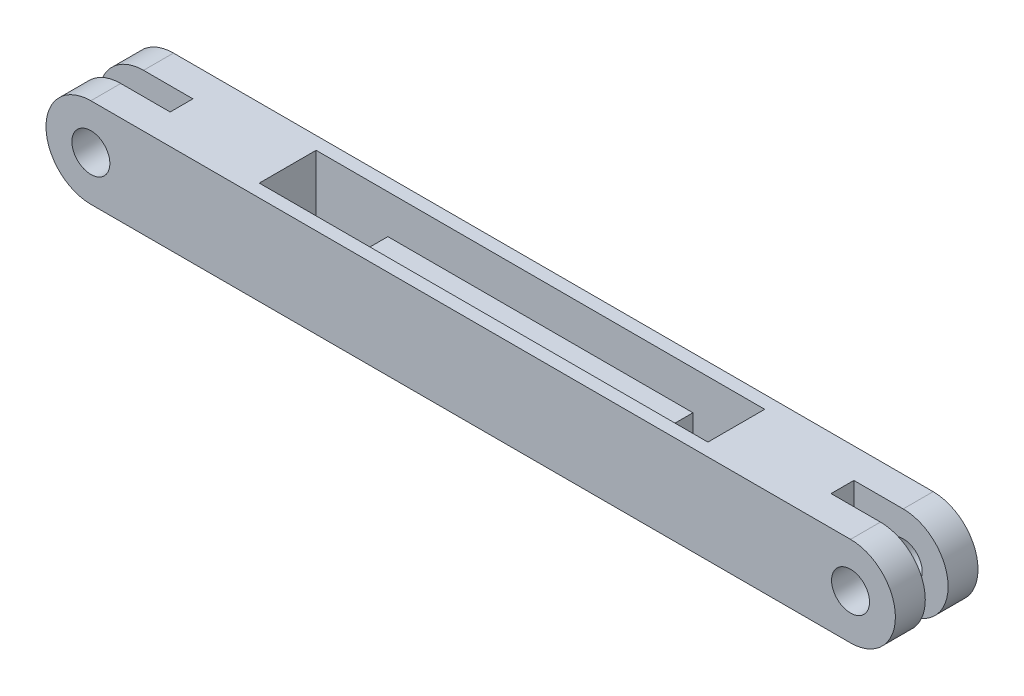
from build123d import *

# Parameters (mm, degrees)
SKETCH1_R           = 3.175
BOSS_EXTRUDE1_DEPTH = 5
SKETCH2_W           = 110.49
SKETCH2_H           = 15
BOSS_EXTRUDE2_DEPTH = 3.81
SKETCH5_R           = 3.175
BOSS_EXTRUDE3_DEPTH = 5
SKETCH6_W           = 75
SKETCH6_H           = 9.5
CUT_EXTRUDE1_DEPTH  = 6.5
SKETCH7_W           = 12
SKETCH7_H           = 9.5
CUT_EXTRUDE2_DEPTH  = 9.294


with BuildPart() as part:
    # Sketch1 → Boss-Extrude1 (new body)
    with BuildSketch(Plane.XY):
        with BuildLine():
            Line((-47.217391304, 7.923913043), (79.782608696, 7.923913043))
            ThreePointArc((79.782608696, 7.923913043), (87.282608696, 0.423913043), (79.782608696, -7.076086957))
            Line((79.782608696, -7.076086957), (-47.217391304, -7.076086957))
            ThreePointArc((-47.217391304, -7.076086957), (-54.717391304, 0.423913043), (-47.217391304, 7.923913043))
        make_face()
        with Locations((-47.217391304, 0.423913043)):
            Circle(SKETCH1_R, mode=Mode.SUBTRACT)
        with Locations((79.782608696, 0.423913043)):
            Circle(SKETCH1_R, mode=Mode.SUBTRACT)
    extrude(amount=BOSS_EXTRUDE1_DEPTH)

    # Sketch2 → Boss-Extrude2 (add)
    with BuildSketch(Plane.XY.offset(5)):
        with Locations((16.282608696, 0.423913043)):
            Rectangle(SKETCH2_W, SKETCH2_H)
    extrude(amount=BOSS_EXTRUDE2_DEPTH)

    # Sketch5 → Boss-Extrude3 (add)
    with BuildSketch(Plane.XY.offset(8.81)):
        with BuildLine():
            Line((-47.217391304, 7.923913043), (79.782608696, 7.923913043))
            ThreePointArc((79.782608696, 7.923913043), (87.282608696, 0.423913043), (79.782608696, -7.076086957))
            Line((79.782608696, -7.076086957), (-47.217391304, -7.076086957))
            ThreePointArc((-47.217391304, -7.076086957), (-54.717391304, 0.423913043), (-47.217391304, 7.923913043))
        make_face()
        with Locations((-47.217391304, 0.423913043)):
            Circle(SKETCH5_R, mode=Mode.SUBTRACT)
        with Locations((79.782608696, 0.423913043)):
            Circle(SKETCH5_R, mode=Mode.SUBTRACT)
    extrude(amount=BOSS_EXTRUDE3_DEPTH)

    # Sketch6 → Cut-Extrude1 (cut)
    with BuildSketch(Plane(origin=(0, 7.923913043, 0), x_dir=(1, 0, 0), z_dir=(0, 1, 0))):
        with Locations((16.282608696, -6.905)):
            Rectangle(SKETCH6_W, SKETCH6_H)
    extrude(amount=-CUT_EXTRUDE1_DEPTH, mode=Mode.SUBTRACT)

    # Sketch7 → Cut-Extrude2 (cut)
    with BuildSketch(Plane(origin=(0, 1.423913043, 0), x_dir=(1, 0, 0), z_dir=(0, 1, 0))):
        with Locations((-15.217391304, -6.905)):
            Rectangle(SKETCH7_W, SKETCH7_H)
        with Locations((47.782608696, -6.905)):
            Rectangle(SKETCH7_W, SKETCH7_H)
    extrude(amount=-CUT_EXTRUDE2_DEPTH, mode=Mode.SUBTRACT)


solid = part.part
